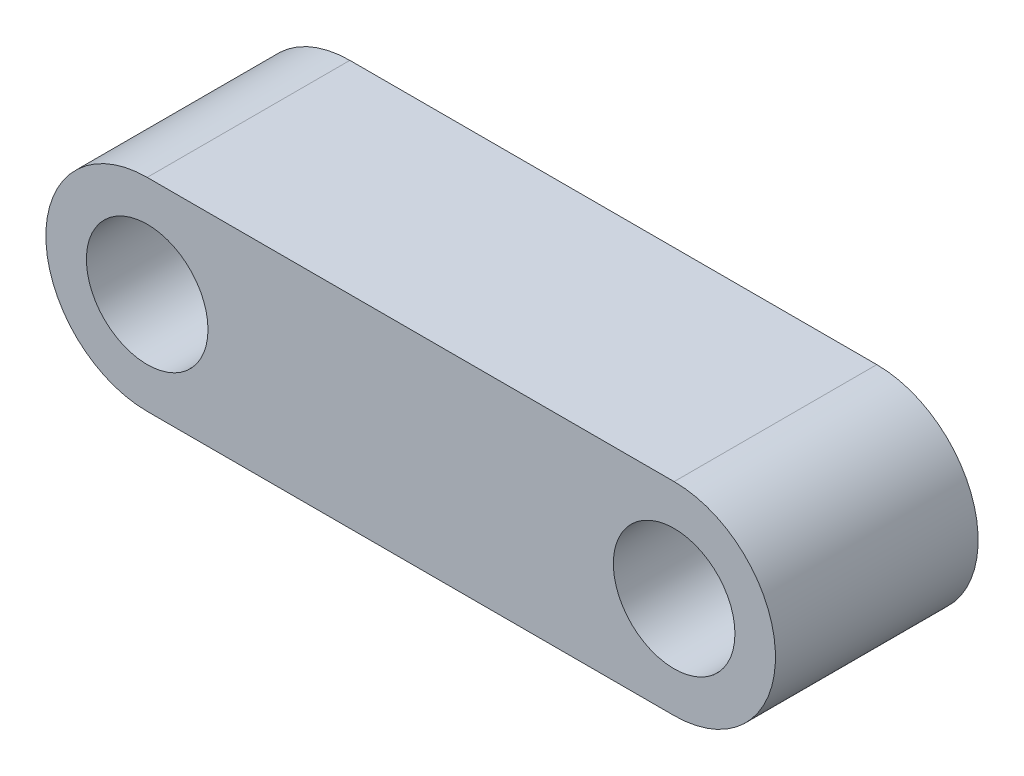
from build123d import *

# Parameters (mm, degrees)
SKETCH1_R           = 1.5
BOSS_EXTRUDE1_DEPTH = 2.5


with BuildPart() as part:
    # Sketch1 → Boss-Extrude1 (new, symmetric)
    with BuildSketch(Plane.XY):
        with BuildLine():
            Line((-6.5, 2.5), (6.5, 2.5))
            ThreePointArc((6.5, 2.5), (9, 0), (6.5, -2.5))
            Line((6.5, -2.5), (-6.5, -2.5))
            ThreePointArc((-6.5, -2.5), (-9, 0), (-6.5, 2.5))
        make_face()
        with Locations((-6.5, 0)):
            Circle(SKETCH1_R, mode=Mode.SUBTRACT)
        with Locations((6.5, 0)):
            Circle(SKETCH1_R, mode=Mode.SUBTRACT)
    extrude(amount=BOSS_EXTRUDE1_DEPTH, both=True)


solid = part.part
